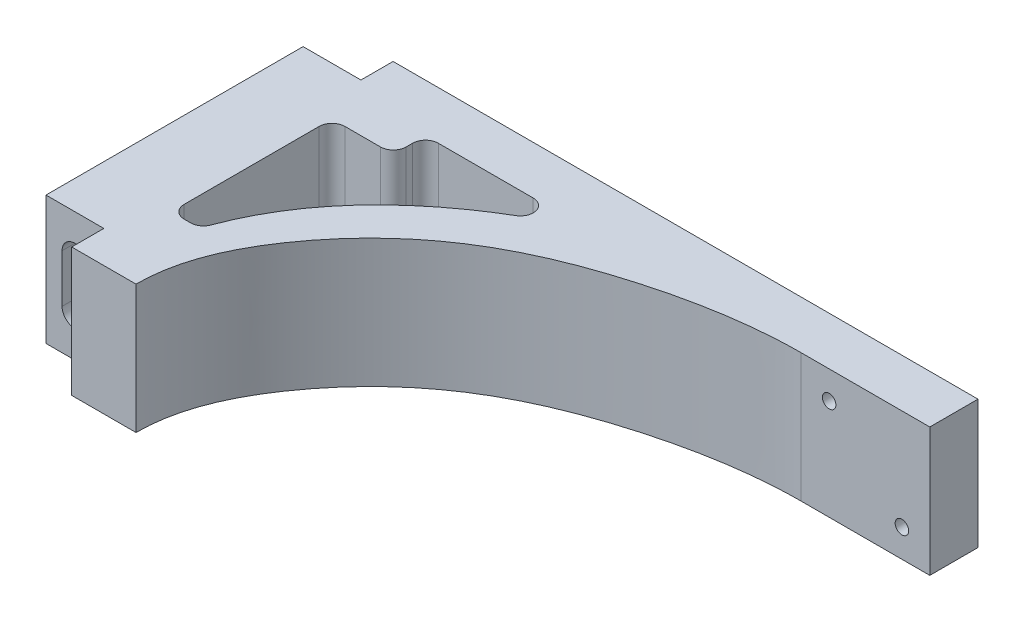
from build123d import *

# Parameters (mm, degrees)
BOSS_EXTRUDE1_DEPTH = 20
SKETCH3_R           = 1.05
CUT_EXTRUDE1_DEPTH  = 20
CUT_EXTRUDE2_DEPTH  = 40


with BuildPart() as part:
    # Sketch2 → Boss-Extrude1 (new body)
    with BuildSketch(Plane(origin=(0, 0, 0), x_dir=(1, 0, 0), z_dir=(0, 1, 0))):
        with BuildLine():
            Line((-28.658256337, 0.746179815), (-28.658256337, -39.253820185))
            Line((-28.658256337, -39.253820185), (-19.658256337, -39.253820185))
            Line((-19.658256337, -39.253820185), (-19.658256337, -44.253820185))
            Line((-19.658256337, -44.253820185), (-9.658256337, -44.253820185))
            add(Edge.make_bspline(
                [(51.341743663, -1.753820185), (43.95022076, -1.753820185), (29.066773176, -4.285907938), (9.29440035, -12.327662678), (-4.675837532, -26.625913431), (-9.658256337, -37.88850288), (-9.658256337, -44.253820185)],
                knots=[0, 0, 0, 0, 0.278287614, 0.548949831, 0.780652353, 1, 1, 1, 1], degree=3))
            Line((51.341743663, -1.753820185), (71.341743663, -1.753820185))
            Line((71.341743663, -1.753820185), (71.341743663, 5.746179815))
            Line((71.341743663, 5.746179815), (-19.658256337, 5.746179815))
            Line((-19.658256337, 5.746179815), (-19.658256337, 0.746179815))
            Line((-19.658256337, 0.746179815), (-28.658256337, 0.746179815))
        make_face()
        with BuildLine():
            Line((-16.658256337, -8.753820185), (-16.658256337, -29.753820185))
            ThreePointArc((-16.658256337, -29.753820185), (-16.072469899, -31.168033747), (-14.658256337, -31.753820185))
            Line((-14.658256337, -31.753820185), (-13.658256337, -31.753820185))
            ThreePointArc((-13.658256337, -31.753820185), (-12.516927691, -31.396187051), (-11.783775986, -30.451189107))
            add(Edge.make_bspline(
                [(-11.783775986, -30.451189107), (-11.274185157, -29.081443531), (-9.924306316, -25.969887858), (-6.252653639, -19.752734333), (0.001148732, -12.823138849), (6.367068894, -8.07935758), (10.008653919, -5.860320829), (10.658890446, -5.478714099)],
                knots=[0.457049826, 0.457049826, 0.457049826, 0.457049826, 0.498595934, 0.553238181, 0.662522676, 0.771807171, 0.79534653, 0.79534653, 0.79534653, 0.79534653], degree=3))
            ThreePointArc((10.658890446, -5.478714099), (11.576593959, -3.229314622), (9.646595536, -1.753820185))
            Line((9.646595536, -1.753820185), (-5.120566965, -1.753820185))
            ThreePointArc((-5.120566965, -1.753820185), (-6.534780528, -2.339606623), (-7.120566965, -3.753820185))
            Line((-7.120566965, -3.753820185), (-7.120566965, -4.753820185))
            ThreePointArc((-7.120566965, -4.753820185), (-7.706353403, -6.168033747), (-9.120566965, -6.753820185))
            Line((-9.120566965, -6.753820185), (-14.658256337, -6.753820185))
            ThreePointArc((-14.658256337, -6.753820185), (-16.072469899, -7.339606623), (-16.658256337, -8.753820185))
        make_face(mode=Mode.SUBTRACT)
    extrude(amount=BOSS_EXTRUDE1_DEPTH)

    # Sketch3 → Cut-Extrude1 (cut)
    with BuildSketch(Plane(origin=(0, 0, -5.746179815), x_dir=(-1, 0, 0), z_dir=(0, 0, -1))):
        with Locations((-55.684889413, 15.656854249)):
            Circle(SKETCH3_R)
        with Locations((-66.998597912, 4.343145751)):
            Circle(SKETCH3_R)
    extrude(amount=-CUT_EXTRUDE1_DEPTH, mode=Mode.SUBTRACT)

    # Sketch4 → Cut-Extrude2 (cut)
    with BuildSketch(Plane(origin=(0, 0, -0.746179815), x_dir=(-1, 0, 0), z_dir=(0, 0, -1))):
        with BuildLine():
            Line((22.158256337, 6.25), (22.158256337, 13.75))
            ThreePointArc((22.158256337, 13.75), (24.158256337, 15.75), (26.158256337, 13.75))
            Line((26.158256337, 13.75), (26.158256337, 6.25))
            ThreePointArc((26.158256337, 6.25), (24.158256337, 4.25), (22.158256337, 6.25))
        make_face()
    extrude(amount=-CUT_EXTRUDE2_DEPTH, mode=Mode.SUBTRACT)


solid = part.part
